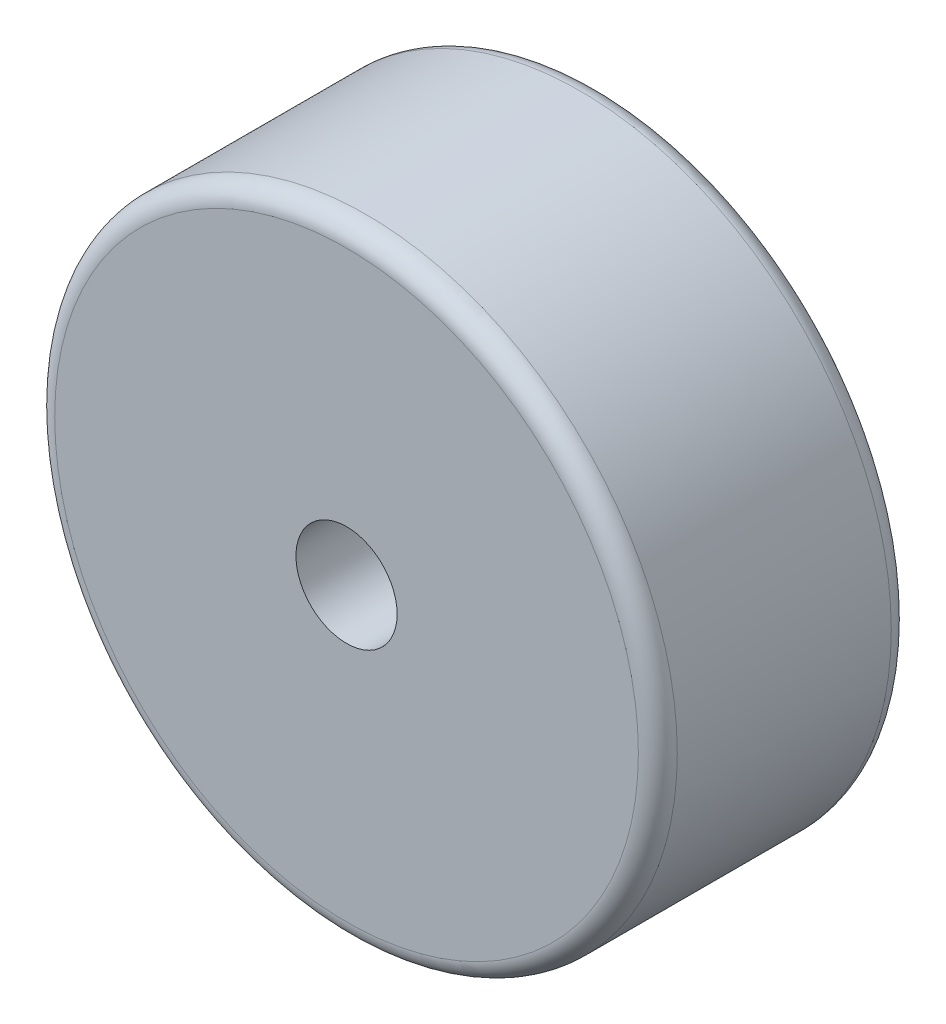
from build123d import *

# Parameters (mm, degrees)
SKETCH_1_R          = 16
EXTRUDE_1_DEPTH     = 13
SKETCH_2_R          = 2.6
CUT_EXTRUDE_1_DEPTH = 27.095976701
FILLET_1_R          = 1


with BuildPart() as part:
    # 草图1 → 凸台-拉伸1 (new body)
    with BuildSketch(Plane.XY):
        with Locations(Location((0, 0, 0), (0, 0, 180))):
            Circle(SKETCH_1_R)
    extrude(amount=EXTRUDE_1_DEPTH)

    # 草图2 → 切除-拉伸1 (cut, through all)
    with BuildSketch(Plane.XY.offset(13)):
        Circle(SKETCH_2_R)
    extrude(amount=-CUT_EXTRUDE_1_DEPTH, mode=Mode.SUBTRACT)

    # 圆角1
    fillet_1_edges = [part.edges().sort_by_distance(p)[0] for p in [
        (16, 0, 0),
        (16, 0, 13),
    ]]
    fillet(fillet_1_edges, radius=FILLET_1_R)


solid = part.part
